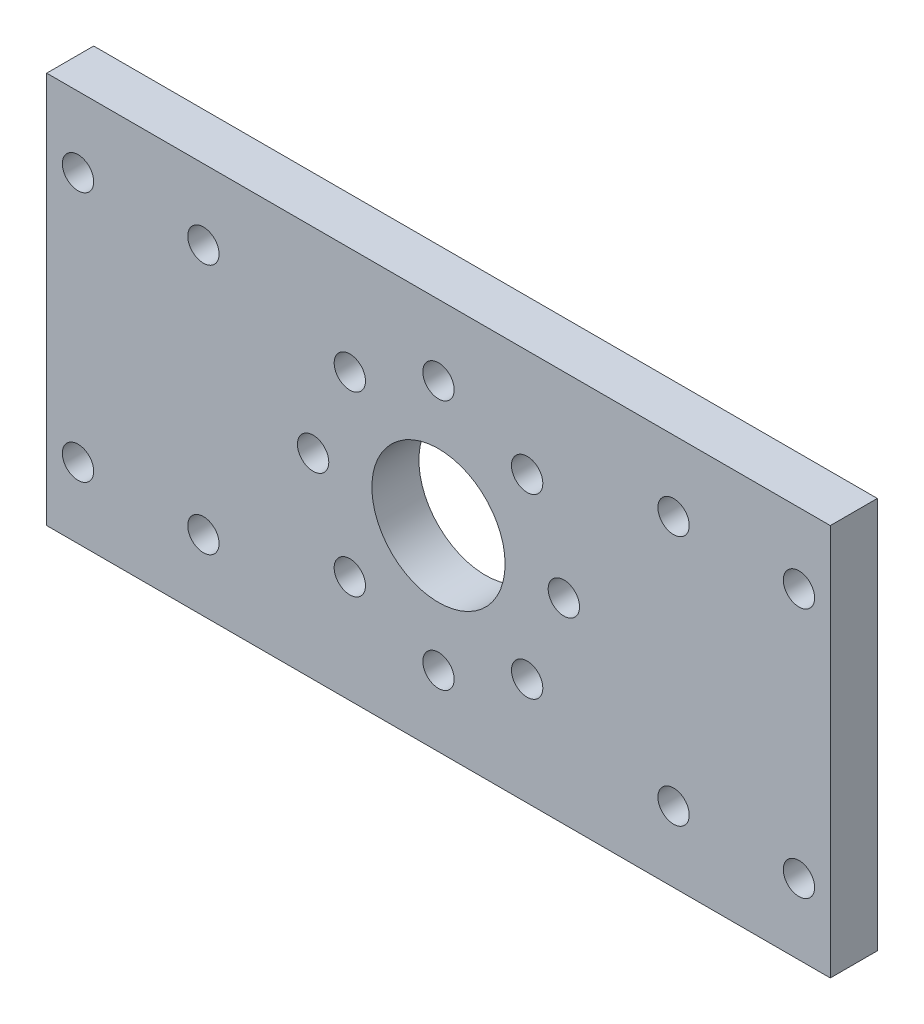
from build123d import *

# Parameters (mm, degrees)
ESBO_O1_W                = 50
ESBO_O1_H                = 25
ESBO_O1_R                = 4.25
ESBO_O1_R_2              = 1
RESSALTO_EXTRUS_O1_DEPTH = 3


with BuildPart() as part:
    # Esboço1 → Ressalto-extrusão1 (new body)
    with BuildSketch(Plane.XY):
        Rectangle(ESBO_O1_W, ESBO_O1_H)
        Circle(ESBO_O1_R, mode=Mode.SUBTRACT)
        with Locations((0, 8)):
            Circle(ESBO_O1_R_2, mode=Mode.SUBTRACT)
        with Locations((5.656854249, 5.656854249)):
            Circle(ESBO_O1_R_2, mode=Mode.SUBTRACT)
        with Locations((8, 0)):
            Circle(ESBO_O1_R_2, mode=Mode.SUBTRACT)
        with Locations((5.656854249, -5.656854249)):
            Circle(ESBO_O1_R_2, mode=Mode.SUBTRACT)
        with Locations((0, -8)):
            Circle(ESBO_O1_R_2, mode=Mode.SUBTRACT)
        with Locations((-5.656854249, -5.656854249)):
            Circle(ESBO_O1_R_2, mode=Mode.SUBTRACT)
        with Locations((-8, 0)):
            Circle(ESBO_O1_R_2, mode=Mode.SUBTRACT)
        with Locations((-5.656854249, 5.656854249)):
            Circle(ESBO_O1_R_2, mode=Mode.SUBTRACT)
        with Locations((-15, 8)):
            Circle(ESBO_O1_R_2, mode=Mode.SUBTRACT)
        with Locations((-15, -8)):
            Circle(ESBO_O1_R_2, mode=Mode.SUBTRACT)
        with Locations(Location((15, -8, 0), (0, 0, 180))):
            Circle(ESBO_O1_R_2, mode=Mode.SUBTRACT)
        with Locations(Location((15, 8, 0), (0, 0, 180))):
            Circle(ESBO_O1_R_2, mode=Mode.SUBTRACT)
        with Locations((23, 8)):
            Circle(ESBO_O1_R_2, mode=Mode.SUBTRACT)
        with Locations((23, -8)):
            Circle(ESBO_O1_R_2, mode=Mode.SUBTRACT)
        with Locations(Location((-23, -8, 0), (0, 0, 180))):
            Circle(ESBO_O1_R_2, mode=Mode.SUBTRACT)
        with Locations(Location((-23, 8, 0), (0, 0, 180))):
            Circle(ESBO_O1_R_2, mode=Mode.SUBTRACT)
    extrude(amount=RESSALTO_EXTRUS_O1_DEPTH)


solid = part.part
